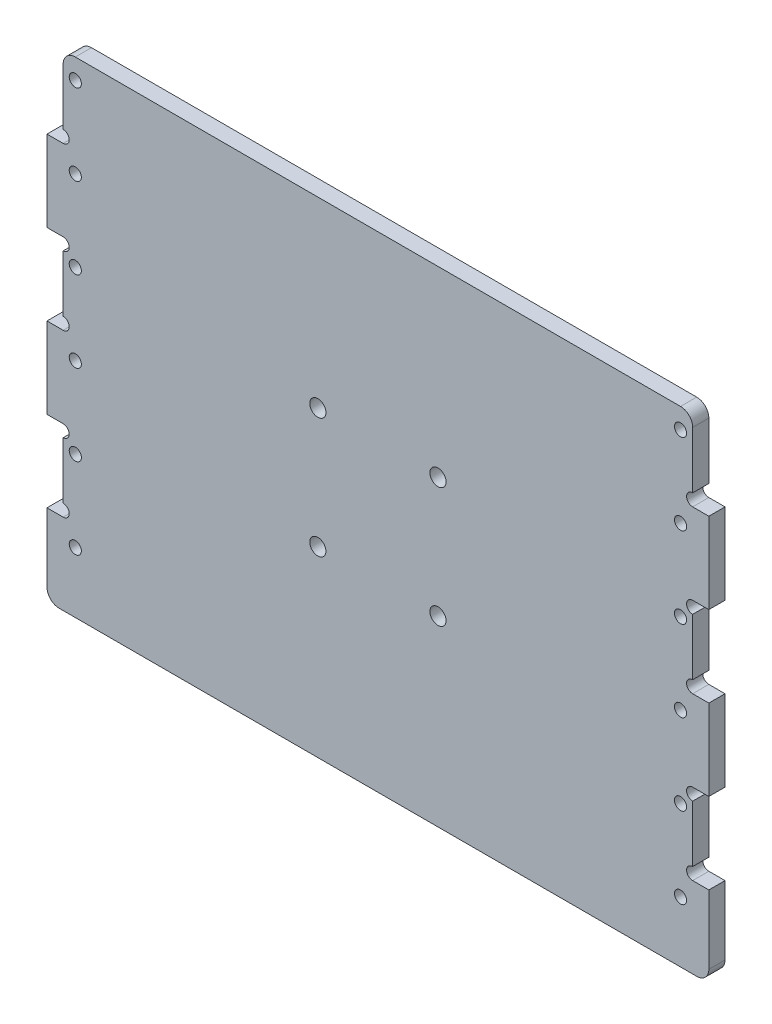
from build123d import *

# Parameters (mm, degrees)
EXTRUDE_1_DEPTH     = 4
FILLET_1_R          = 3
SKETCH_2_R          = 1.5
SKETCH_2_R_2        = 2
CUT_EXTRUDE_1_DEPTH = 4


with BuildPart() as part:
    # 草图1 → 凸台-拉伸1 (new body)
    with BuildSketch(Plane.XY):
        with BuildLine():
            Line((77.8, 60), (-77.8, 60))
            Line((-77.8, 60), (-77.8, 43))
            ThreePointArc((-77.8, 43), (-76.3, 41.5), (-77.8, 40))
            Line((-77.8, 40), (-81.8, 40))
            Line((-81.8, 40), (-81.8, 20))
            Line((-81.8, 20), (-77.8, 20))
            ThreePointArc((-77.8, 20), (-76.3, 18.5), (-77.8, 17))
            Line((-77.8, 17), (-77.8, 3))
            ThreePointArc((-77.8, 3), (-76.3, 1.5), (-77.8, 0))
            Line((-77.8, 0), (-81.8, 0))
            Line((-81.8, 0), (-81.8, -20))
            Line((-81.8, -20), (-77.8, -20))
            ThreePointArc((-77.8, -20), (-76.3, -21.5), (-77.8, -23))
            Line((-77.8, -23), (-77.8, -37))
            ThreePointArc((-77.8, -37), (-76.3, -38.5), (-77.8, -40))
            Line((-77.8, -40), (-81.8, -40))
            Line((-81.8, -40), (-81.8, -60))
            Line((-81.8, -60), (81.8, -60))
            Line((81.8, -60), (81.8, -40))
            Line((81.8, -40), (77.8, -40))
            ThreePointArc((77.8, -40), (76.3, -38.5), (77.8, -37))
            Line((77.8, -37), (77.8, -23))
            ThreePointArc((77.8, -23), (76.3, -21.5), (77.8, -20))
            Line((77.8, -20), (81.8, -20))
            Line((81.8, -20), (81.8, 0))
            Line((81.8, 0), (77.8, 0))
            ThreePointArc((77.8, 0), (76.3, 1.5), (77.8, 3))
            Line((77.8, 3), (77.8, 17))
            ThreePointArc((77.8, 17), (76.3, 18.5), (77.8, 20))
            Line((77.8, 20), (81.8, 20))
            Line((81.8, 20), (81.8, 40))
            Line((81.8, 40), (77.8, 40))
            ThreePointArc((77.8, 40), (76.3, 41.5), (77.8, 43))
            Line((77.8, 43), (77.8, 60))
        make_face()
    extrude(amount=EXTRUDE_1_DEPTH)

    # 圆角1
    fillet_1_edges = [part.edges().sort_by_distance(p)[0] for p in [
        (77.8, 60, 2),
        (-77.8, 60, 2),
        (-81.8, -60, 2),
        (81.8, -60, 2),
    ]]
    fillet(fillet_1_edges, radius=FILLET_1_R)

    # 草图2 → 切除-拉伸1 (cut)
    with BuildSketch(Plane.XY.offset(4)):
        with Locations((-74.8, 55)):
            Circle(SKETCH_2_R)
        with Locations((-74.8, 35)):
            Circle(SKETCH_2_R)
        with Locations((-74.8, 15)):
            Circle(SKETCH_2_R)
        with Locations((-74.8, -5)):
            Circle(SKETCH_2_R)
        with Locations((-74.8, -25)):
            Circle(SKETCH_2_R)
        with Locations((-74.8, -45)):
            Circle(SKETCH_2_R)
        with Locations((74.8, -45)):
            Circle(SKETCH_2_R)
        with Locations((74.8, -25)):
            Circle(SKETCH_2_R)
        with Locations((74.8, -5)):
            Circle(SKETCH_2_R)
        with Locations((74.8, 15)):
            Circle(SKETCH_2_R)
        with Locations((74.8, 35)):
            Circle(SKETCH_2_R)
        with Locations((74.8, 55)):
            Circle(SKETCH_2_R)
        with Locations((-14.849242405, 14.849242405)):
            Circle(SKETCH_2_R_2)
        with Locations((14.849242405, 14.849242405)):
            Circle(SKETCH_2_R_2)
        with Locations((14.849242405, -14.849242405)):
            Circle(SKETCH_2_R_2)
        with Locations((-14.849242405, -14.849242405)):
            Circle(SKETCH_2_R_2)
    extrude(amount=-CUT_EXTRUDE_1_DEPTH, mode=Mode.SUBTRACT)


solid = part.part
